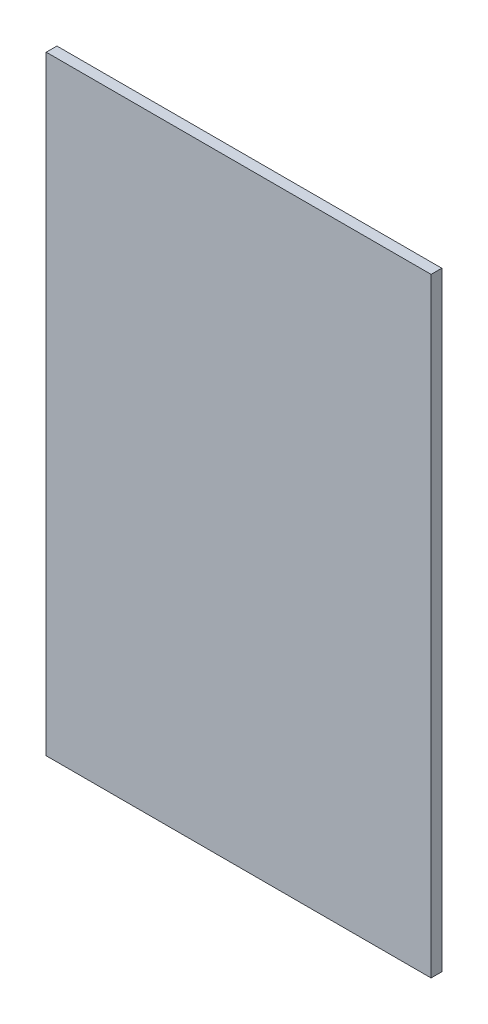
from build123d import *

# Parameters (mm, degrees)
SKETCH1_W           = 228.6
SKETCH1_H           = 361.95
BOSS_EXTRUDE1_DEPTH = 3.175


with BuildPart() as part:
    # Sketch1 → Boss-Extrude1 (new, symmetric)
    with BuildSketch(Plane.XY):
        Rectangle(SKETCH1_W, SKETCH1_H)
    extrude(amount=BOSS_EXTRUDE1_DEPTH, both=True)


solid = part.part
